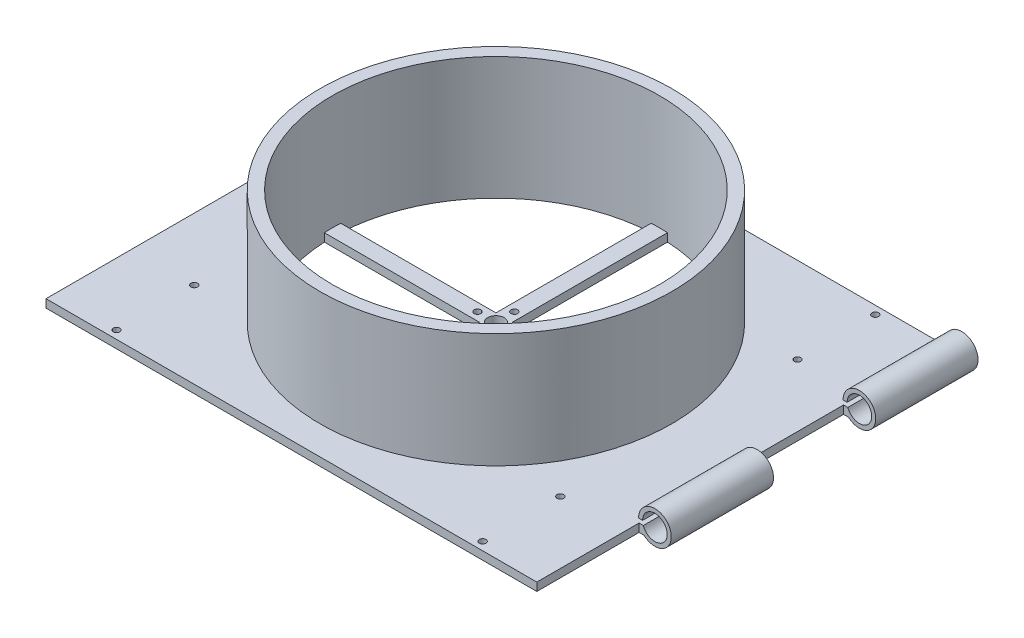
from build123d import *

# Parameters (mm, degrees)
CROQUIS1_R              = 43
CROQUIS1_R_2            = 40
SALIENTE_EXTRUIR1_DEPTH = 30
CROQUIS3_R              = 0.81
CROQUIS3_R_2            = 2
SALIENTE_EXTRUIR2_DEPTH = 2
CROQUIS4_W              = 120
CROQUIS4_H              = 100
CROQUIS4_R              = 43
SALIENTE_EXTRUIR3_DEPTH = 2
CROQUIS5_R              = 0.81
CORTAR_EXTRUIR1_DEPTH   = 2
SALIENTE_EXTRUIR8_DEPTH = 25
MATRIZL2_COUNT          = 2
MATRIZL2_PITCH          = 50


with BuildPart() as part:
    # Croquis1 → Saliente-Extruir1 (new body)
    with BuildSketch(Plane(origin=(0, 0, 0), x_dir=(1, 0, 0), z_dir=(0, 1, 0))):
        with Locations(Location((0, 0, 0), (0, 0, 270))):
            Circle(CROQUIS1_R)
        with Locations(Location((0, 0, 0), (0, 0, 270))):
            Circle(CROQUIS1_R_2, mode=Mode.SUBTRACT)
    extrude(amount=SALIENTE_EXTRUIR1_DEPTH)

    # Croquis3 → Saliente-Extruir2 (add)
    with BuildSketch(Plane(origin=(0, 0, 0), x_dir=(1, 0, 0), z_dir=(0, 1, 0))):
        with BuildLine():
            Line((-2, 39.949968711), (-2, 2))
            Line((-2, 2), (-39.949968711, 2))
            ThreePointArc((-39.949968711, 2), (-40, 0), (-39.949968711, -2))
            Line((-39.949968711, -2), (-2, -2))
            Line((-2, -2), (-2, -39.949968711))
            ThreePointArc((-2, -39.949968711), (0, -40), (2, -39.949968711))
            Line((2, -39.949968711), (2, -2))
            Line((2, -2), (39.949968711, -2))
            ThreePointArc((39.949968711, -2), (39.987490222, -1.000312842), (40, 0))
            ThreePointArc((40, 0), (39.987490222, 1.000312842), (39.949968711, 2))
            Line((39.949968711, 2), (2, 2))
            Line((2, 2), (2, 39.949968711))
            ThreePointArc((2, 39.949968711), (0, 40), (-2, 39.949968711))
        make_face()
        with Locations(Location((0, -4.5, 0), (0, 0, 270))):
            Circle(CROQUIS3_R, mode=Mode.SUBTRACT)
        with Locations(Location((-4.5, 0, 0), (0, 0, 270))):
            Circle(CROQUIS3_R, mode=Mode.SUBTRACT)
        with Locations(Location((0, 0, 0), (0, 0, 270))):
            Circle(CROQUIS3_R_2, mode=Mode.SUBTRACT)
        with Locations(Location((4.5, 0, 0), (0, 0, 270))):
            Circle(CROQUIS3_R, mode=Mode.SUBTRACT)
        with Locations(Location((0, 4.5, 0), (0, 0, 270))):
            Circle(CROQUIS3_R, mode=Mode.SUBTRACT)
    extrude(amount=SALIENTE_EXTRUIR2_DEPTH)

    # Croquis4 → Saliente-Extruir3 (add)
    with BuildSketch(Plane(origin=(0, 0, 0), x_dir=(1, 0, 0), z_dir=(0, 1, 0))):
        Rectangle(CROQUIS4_W, CROQUIS4_H)
        with Locations(Location((0, 0, 0), (0, 0, 90))):
            Circle(CROQUIS4_R, mode=Mode.SUBTRACT)
    extrude(amount=SALIENTE_EXTRUIR3_DEPTH)

    # Croquis5 → Cortar-Extruir1 (cut)
    with BuildSketch(Plane(origin=(0, 2, 0), x_dir=(1, 0, 0), z_dir=(0, 1, 0))):
        with Locations(Location((-44.755, -48, 0), (0, 0, 270))):
            Circle(CROQUIS5_R)
        with Locations(Location((-44.755, -29, 0), (0, 0, 270))):
            Circle(CROQUIS5_R)
        with Locations(Location((-44.755, 29, 0), (0, 0, 90))):
            Circle(CROQUIS5_R)
        with Locations(Location((-44.755, 48, 0), (0, 0, 90))):
            Circle(CROQUIS5_R)
        with Locations(Location((44.755, -48, 0), (0, 0, 90))):
            Circle(CROQUIS5_R)
        with Locations(Location((44.755, -29, 0), (0, 0, 90))):
            Circle(CROQUIS5_R)
        with Locations(Location((44.755, 29, 0), (0, 0, 270))):
            Circle(CROQUIS5_R)
        with Locations(Location((44.755, 48, 0), (0, 0, 270))):
            Circle(CROQUIS5_R)
    extrude(amount=-CORTAR_EXTRUIR1_DEPTH, mode=Mode.SUBTRACT)

    # Croquis7 → Saliente-Extruir8 (add)
    with BuildSketch(Plane(origin=(0, 0, -50), x_dir=(-1, 0, 0), z_dir=(0, 0, -1))):
        with BuildLine():
            Line((-60, 2), (-61.044556221, 2))
            ThreePointArc((-61.044556221, 2), (-66.829779025, 3.507305936), (-60.872983346, 3))
            Line((-60.872983346, 3), (-59.872983346, 3))
            ThreePointArc((-59.872983346, 3), (-67.518734657, 4.645751311), (-61.227232035, 0))
            Line((-61.227232035, 0), (-60, 0))
            Line((-60, 0), (-60, 2))
        make_face()
    saliente_extruir8 = extrude(amount=-SALIENTE_EXTRUIR8_DEPTH)

    # MatrizL2: Saliente-Extruir8 ×2
    with Locations(*[(0, 0, i * MATRIZL2_PITCH) for i in range(1, MATRIZL2_COUNT)]):
        add(saliente_extruir8)


solid = part.part
